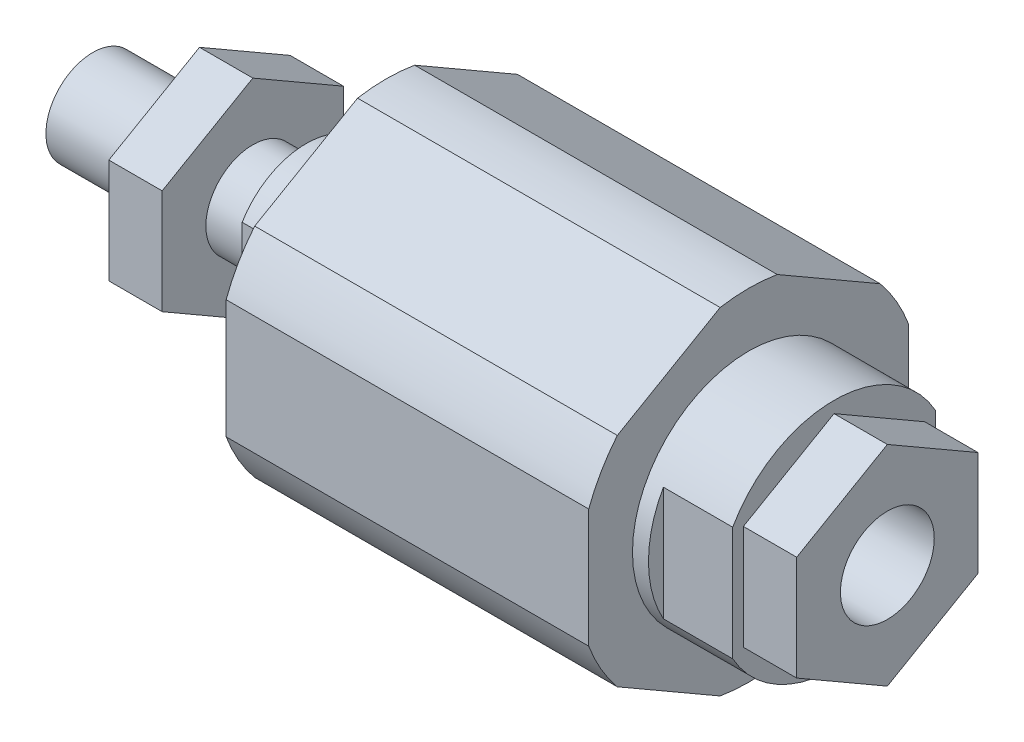
from build123d import *

# Parameters (mm, degrees)
OUTSIDE_FLATSS_OUTSIDE_W = 50.588
OUTSIDE_FLATSS_OUTSIDE_H = 50.588
OUTSIDE_FLATS_DEPTH      = 74.090697082
FRONT_NUT_DEPTH          = 5
FRONT_START              = -6.5
FRONT_FLATS_DEPTH        = 6.5
REAR_FLATS_DEPTH         = 6.5
REAR_START               = 5
REAR_NUT_SK_R            = 4.4
REAR_NUT_DEPTH           = 5


with BuildPart() as part:
    # Bodies → Body (revolve)
    with BuildSketch(Plane.XY):
        Polygon((-69.5, 4.4), (-49.5, 4.4), (-49.5, 7), (-42, 7), (-42, 16), (-8, 16), (-8, 10.9), (0, 10.9), (0, 4.4), (-23, 4.4), (-23, 0), (-69.5, 0), align=None)
    revolve(axis=Axis((0, 0, 0), (-1, 0, 0)))

    # Outside Flatss outside → Outside Flats (cut, through all)
    with BuildSketch(Plane.ZY.offset(69.5)):
        Rectangle(OUTSIDE_FLATSS_OUTSIDE_W, OUTSIDE_FLATSS_OUTSIDE_H)
        Polygon((0, 17.320508076), (15, 8.660254038), (15, -8.660254038), (0, -17.320508076), (-15, -8.660254038), (-15, 8.660254038), align=None, mode=Mode.SUBTRACT)
    extrude(amount=-OUTSIDE_FLATS_DEPTH, mode=Mode.SUBTRACT)

    # Front Nuts → Front Nut (add)
    with BuildSketch(Plane.ZY.offset(59.5)):
        Polygon((0, 9.814954576), (8.5, 4.907477288), (8.5, -4.907477288), (0, -9.814954576), (-8.5, -4.907477288), (-8.5, 4.907477288), align=None)
    extrude(amount=-FRONT_NUT_DEPTH)

    # Front Flatss → Front Flats (cut)
    with BuildSketch(Plane.ZY.offset(49.5).offset(FRONT_START)):
        with BuildLine():
            Line((-6, 3.605551275), (-6, -3.605551275))
            ThreePointArc((-6, -3.605551275), (-7, 0), (-6, 3.605551275))
        make_face()
        with BuildLine():
            Line((6, 3.605551275), (6, -3.605551275))
            ThreePointArc((6, -3.605551275), (7, 0), (6, 3.605551275))
        make_face()
    extrude(amount=FRONT_FLATS_DEPTH, mode=Mode.SUBTRACT)

    # Rear Flatss → Rear Flats (cut)
    with BuildSketch(Plane(origin=(0, 0, 0), x_dir=(0, 0, -1), z_dir=(1, 0, 0))):
        with BuildLine():
            Line((-9.5, 5.344155686), (-9.5, -5.344155686))
            ThreePointArc((-9.5, -5.344155686), (-10.9, 0), (-9.5, 5.344155686))
        make_face()
        with BuildLine():
            Line((9.5, 5.344155686), (9.5, -5.344155686))
            ThreePointArc((9.5, -5.344155686), (10.9, 0), (9.5, 5.344155686))
        make_face()
    extrude(amount=-REAR_FLATS_DEPTH, mode=Mode.SUBTRACT)

    # Rear Nut sk → Rear Nut (add)
    with BuildSketch(Plane(origin=(0, 0, 0), x_dir=(0, 0, -1), z_dir=(1, 0, 0)).offset(REAR_START)):
        Polygon((8.5, 4.907477288), (0, 9.814954576), (-8.5, 4.907477288), (-8.5, -4.907477288), (0, -9.814954576), (8.5, -4.907477288), align=None)
        Circle(REAR_NUT_SK_R, mode=Mode.SUBTRACT)
    extrude(amount=-REAR_NUT_DEPTH)


solid = part.part
